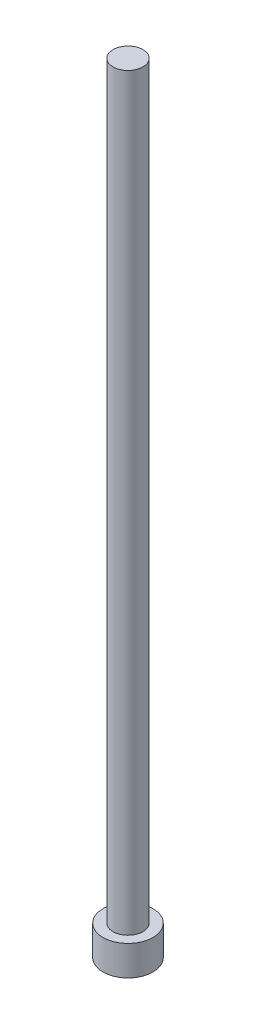
from build123d import *

# Parameters (mm, degrees)
SKETCH1_R           = 2.5
BOSS_EXTRUDE1_DEPTH = 3
SKETCH2_R           = 1.5
BOSS_EXTRUDE2_DEPTH = 75


with BuildPart() as part:
    # Sketch1 → Boss-Extrude1 (new body)
    with BuildSketch(Plane(origin=(0, 0, 0), x_dir=(1, 0, 0), z_dir=(0, 1, 0))):
        with Locations(Location((0, 0, 0), (0, 0, 270))):
            Circle(SKETCH1_R)
    extrude(amount=BOSS_EXTRUDE1_DEPTH)

    # Sketch2 → Boss-Extrude2 (add)
    with BuildSketch(Plane(origin=(0, 3, 0), x_dir=(1, 0, 0), z_dir=(0, 1, 0))):
        with Locations(Location((0, 0, 0), (0, 0, 270))):
            Circle(SKETCH2_R)
    extrude(amount=BOSS_EXTRUDE2_DEPTH)


solid = part.part
